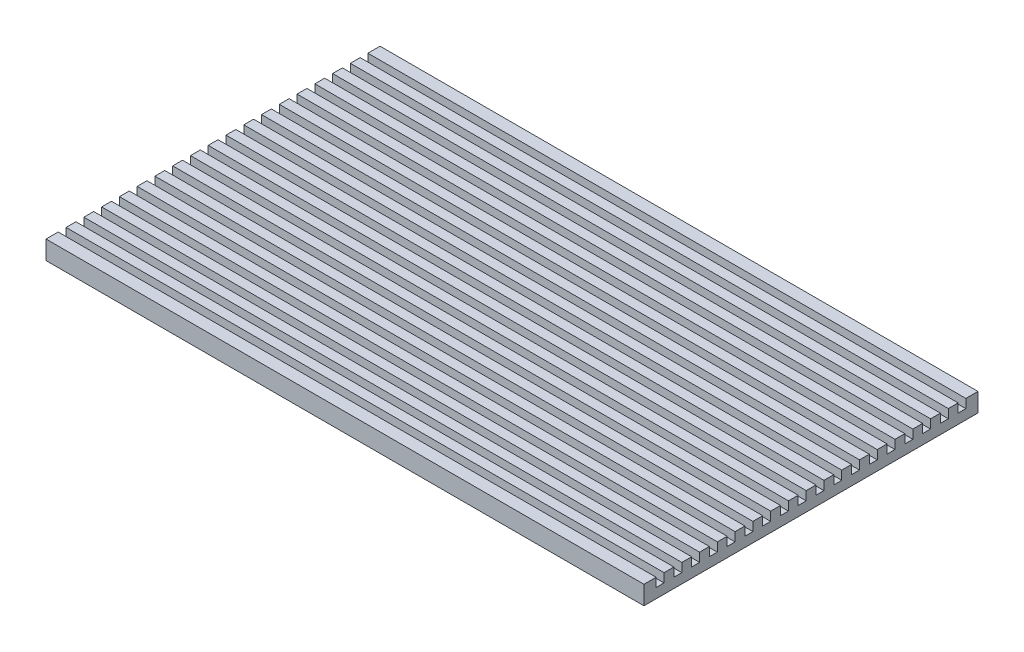
from build123d import *

# Parameters (mm, degrees)
BOSS_EXTRUDE1_DEPTH      = 2.1
BOSS_EXTRUDE1_DEPTH_BACK = 0.0001
SKETCH1_W                = 128
SKETCH1_H                = 71.5
SKETCH2_W                = 128
SKETCH2_H                = 2.6
BOSS_EXTRUDE2_DEPTH      = 1.8999
SKETCH3_W                = 128
SKETCH3_H                = 2.1
BOSS_EXTRUDE3_DEPTH      = 1.8999
LPATTERN1_COUNT          = 17
LPATTERN1_PITCH          = 3.803125
SKETCH6_W                = 105
SKETCH6_H                = 19.25
BOSS_EXTRUDE4_DEPTH      = 5.5


with BuildPart() as part:
    # Sketch1 → Boss-Extrude1 (new, two sides: drawn at the far end of the back side and taken through both)
    with BuildSketch(Plane(origin=(0, 0, 0), x_dir=(1, 0, 0), z_dir=(0, 1, 0)).offset(-BOSS_EXTRUDE1_DEPTH_BACK)):
        Rectangle(SKETCH1_W, SKETCH1_H)
    extrude(amount=BOSS_EXTRUDE1_DEPTH + BOSS_EXTRUDE1_DEPTH_BACK)

    # Sketch2 → Boss-Extrude2 (add)
    with BuildSketch(Plane(origin=(0, 2.1, 0), x_dir=(1, 0, 0), z_dir=(0, 1, 0))):
        with Locations((0, -34.45)):
            Rectangle(SKETCH2_W, SKETCH2_H)
        with Locations((0, 34.45)):
            Rectangle(SKETCH2_W, SKETCH2_H)
    extrude(amount=BOSS_EXTRUDE2_DEPTH)

    # Sketch3 → Boss-Extrude3 (add)
    with BuildSketch(Plane(origin=(0, 2.1, 0), x_dir=(1, 0, 0), z_dir=(0, 1, 0))):
        with Locations((0, -30.4)):
            Rectangle(SKETCH3_W, SKETCH3_H)
    boss_extrude3 = extrude(amount=BOSS_EXTRUDE3_DEPTH)

    # LPattern1: Boss-Extrude3 ×17
    with Locations(*[(0, 0, -i * LPATTERN1_PITCH) for i in range(1, LPATTERN1_COUNT)]):
        add(boss_extrude3)

    # Sketch6 → Boss-Extrude4 (add)
    with BuildSketch(Plane.XZ.offset(0.0001)):
        with Locations((0, -13.15)):
            Rectangle(SKETCH6_W, SKETCH6_H)
    extrude(amount=BOSS_EXTRUDE4_DEPTH)


solid = part.part
